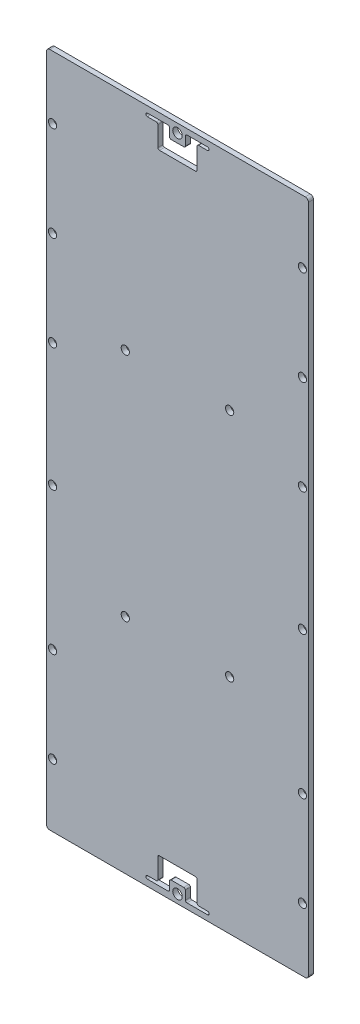
from build123d import *

# Parameters (mm, degrees)
SKETCH1_R                = 0.8
PCB_EXTRUDE_DEPTH        = 1.6
CORNER_FILLETS_ON_PCB_R  = 1
SKETCH3_R                = 1.5
SOLAR_HOLE_DEPTH         = 1.6
FILLETS_FOR_SOLAR_HOLE_R = 0.5
M2_CLEARANCE_HOLE1_D     = 2.6


with BuildPart() as part:
    # Sketch1 → pcb extrude (new body)
    with BuildSketch(Plane.XY):
        Polygon((41.4, 99), (41.4, 106.9), (-41.4, 106.9), (-41.4, 99), (-41.4, 93.95), (-41.4, 88.45), (-41.4, 33.95), (-41.4, 28.45), (-41.4, -28.45), (-41.4, -33.95), (-41.4, -88.45), (-41.4, -93.95), (-41.4, -99), (-41.4, -106.9), (41.4, -106.9), (41.4, -99), (41.4, -93.95), (41.4, -88.45), (41.4, -33.95), (41.4, -28.45), (41.4, 28.45), (41.4, 33.95), (41.4, 88.45), (41.4, 93.95), align=None)
        with Locations((-39.5, -87)):
            Circle(SKETCH1_R, mode=Mode.SUBTRACT)
        with Locations((-39.5, -57)):
            Circle(SKETCH1_R, mode=Mode.SUBTRACT)
        with Locations((0, -104.2)):
            Circle(SKETCH1_R, mode=Mode.SUBTRACT)
        with Locations((-39.5, -12)):
            Circle(SKETCH1_R, mode=Mode.SUBTRACT)
        with Locations((-16.5, -36.5)):
            Circle(SKETCH1_R, mode=Mode.SUBTRACT)
        with Locations((39.5, -87)):
            Circle(SKETCH1_R, mode=Mode.SUBTRACT)
        with Locations((39.5, -57)):
            Circle(SKETCH1_R, mode=Mode.SUBTRACT)
        with Locations((16.5, -36.5)):
            Circle(SKETCH1_R, mode=Mode.SUBTRACT)
        with Locations((39.5, -12)):
            Circle(SKETCH1_R, mode=Mode.SUBTRACT)
        with Locations((-39.5, 27)):
            Circle(SKETCH1_R, mode=Mode.SUBTRACT)
        with Locations((-16.5, 36.5)):
            Circle(SKETCH1_R, mode=Mode.SUBTRACT)
        with Locations((-39.5, 57)):
            Circle(SKETCH1_R, mode=Mode.SUBTRACT)
        with Locations((-39.5, 87)):
            Circle(SKETCH1_R, mode=Mode.SUBTRACT)
        with Locations((0, 104.2)):
            Circle(SKETCH1_R, mode=Mode.SUBTRACT)
        with Locations((16.5, 36.5)):
            Circle(SKETCH1_R, mode=Mode.SUBTRACT)
        with Locations((39.5, 27)):
            Circle(SKETCH1_R, mode=Mode.SUBTRACT)
        with Locations((39.5, 57)):
            Circle(SKETCH1_R, mode=Mode.SUBTRACT)
        with Locations((39.5, 87)):
            Circle(SKETCH1_R, mode=Mode.SUBTRACT)
    extrude(amount=PCB_EXTRUDE_DEPTH)

    # corner fillets on PCB
    corner_fillets_on_pcb_edges = [part.edges().sort_by_distance(p)[0] for p in [
        (41.4, -106.9, 0.8),
        (-41.4, -106.9, 0.8),
        (-41.4, 106.9, 0.8),
        (41.4, 106.9, 0.8),
    ]]
    fillet(corner_fillets_on_pcb_edges, radius=CORNER_FILLETS_ON_PCB_R)

    # Sketch3 → Solar Hole (cut)
    with BuildSketch(Plane.XY.offset(1.6)):
        with Locations((0, 104.2)):
            Circle(SKETCH3_R)
        with BuildLine():
            Line((-2.5, 101.4), (2.5, 101.4))
            Line((2.5, 101.4), (2.5, 105.146203888))
            Line((2.5, 105.146203888), (9.5, 105.146203888))
            ThreePointArc((9.5, 105.146203888), (10, 104.646203888), (9.5, 104.146203888))
            Line((9.5, 104.146203888), (6.2, 104.146203888))
            Line((6.2, 104.146203888), (6.2, 101.646203888))
            Line((6.2, 101.646203888), (6.2, 96.6))
            Line((6.2, 96.6), (-6.2, 96.6))
            Line((-6.2, 96.6), (-6.2, 101.4))
            Line((-6.2, 101.4), (-6.2, 103.9))
            Line((-6.2, 103.9), (-9.5, 103.9))
            ThreePointArc((-9.5, 103.9), (-10, 104.4), (-9.5, 104.9))
            Line((-9.5, 104.9), (-2.5, 104.9))
            Line((-2.5, 104.9), (-2.5, 101.4))
        make_face()
    solar_hole = extrude(amount=-SOLAR_HOLE_DEPTH, mode=Mode.SUBTRACT)

    # Mirror solar hole: Solar Hole across plane
    add(solar_hole.mirror(Plane.ZX), mode=Mode.SUBTRACT)

    # fillets for solar hole
    fillets_for_solar_hole_edges = [part.edges().sort_by_distance(p)[0] for p in [
        (6.2, 96.6, 0.8),
        (-6.2, 96.6, 0.8),
        (-6.2, 103.9, 0.8),
        (-2.5, 104.9, 0.8),
        (-2.5, 101.4, 0.8),
        (2.5, 101.4, 0.8),
        (2.5, 105.146203888, 0.8),
        (6.2, 104.146203888, 0.8),
        (-6.2, -96.6, 0.8),
        (-6.2, -103.9, 0.8),
        (-2.5, -104.9, 0.8),
        (-2.5, -101.4, 0.8),
        (2.5, -101.4, 0.8),
        (2.5, -105.146203888, 0.8),
        (6.2, -104.146203888, 0.8),
        (6.2, -96.6, 0.8),
    ]]
    fillet(fillets_for_solar_hole_edges, radius=FILLETS_FOR_SOLAR_HOLE_R)

    # M2 Clearance Hole1 (through all)
    with Locations(Plane(origin=(0, 0, 0), x_dir=(-1, 0, 0), z_dir=(0, 0, -1))):
        with Locations((39.5, 87), (-39.5, 87), (16.5, 36.5), (-16.5, 36.5), (39.5, 57), (-39.5, 57), (39.5, 27), (-39.5, 27), (39.5, -12), (-39.5, -12), (39.5, -57), (16.5, -36.5), (-16.5, -36.5), (-39.5, -57), (-39.5, -87), (39.5, -87)):
            Hole(M2_CLEARANCE_HOLE1_D / 2)


solid = part.part
